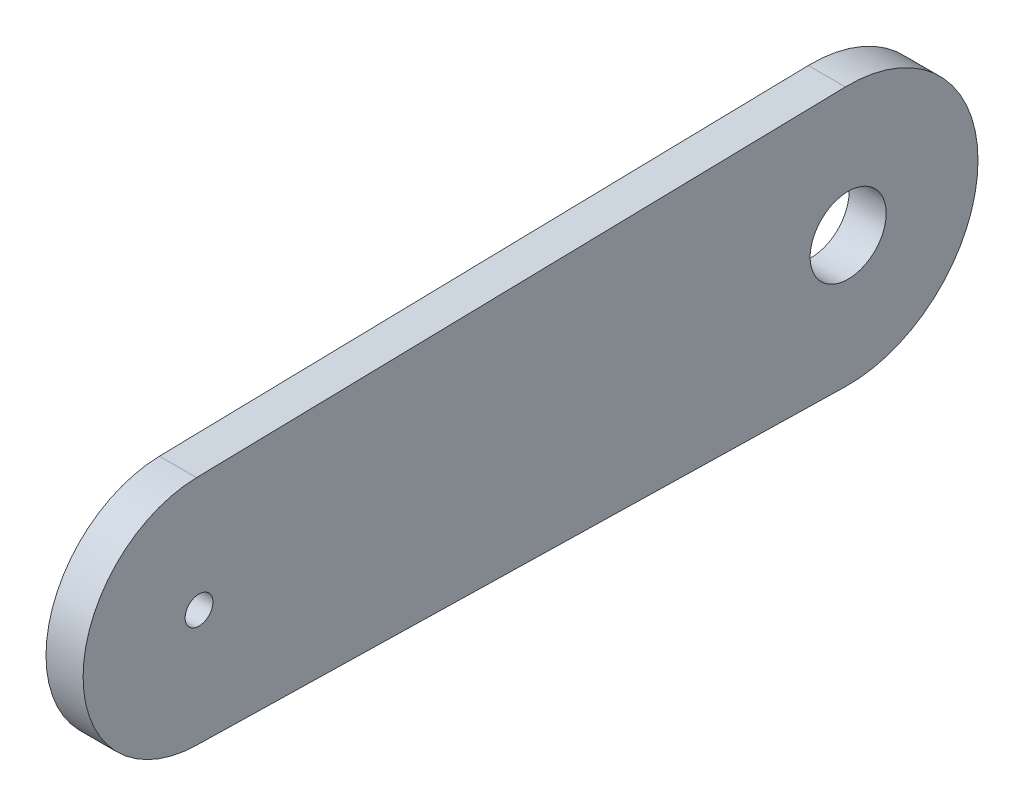
from build123d import *

# Parameters (mm, degrees)
CROQUIS1_R              = 4.1
CROQUIS1_R_2            = 1.5
SALIENTE_EXTRUIR1_DEPTH = 4


with BuildPart() as part:
    # Croquis1 → Saliente-Extruir1 (new body)
    with BuildSketch(Plane(origin=(0, 0, 0), x_dir=(0, 0, -1), z_dir=(1, 0, 0))):
        with BuildLine():
            Line((-70.267857143, 12.497129773), (-0.3, 13.996785345))
            ThreePointArc((-0.3, 13.996785345), (14, 0), (-0.3, -13.996785345))
            Line((-0.3, -13.996785345), (-70.267857143, -12.497129773))
            ThreePointArc((-70.267857143, -12.497129773), (-82.5, 0), (-70.267857143, 12.497129773))
        make_face()
        Circle(CROQUIS1_R, mode=Mode.SUBTRACT)
        with Locations((-70, 0)):
            Circle(CROQUIS1_R_2, mode=Mode.SUBTRACT)
    extrude(amount=SALIENTE_EXTRUIR1_DEPTH)


solid = part.part
